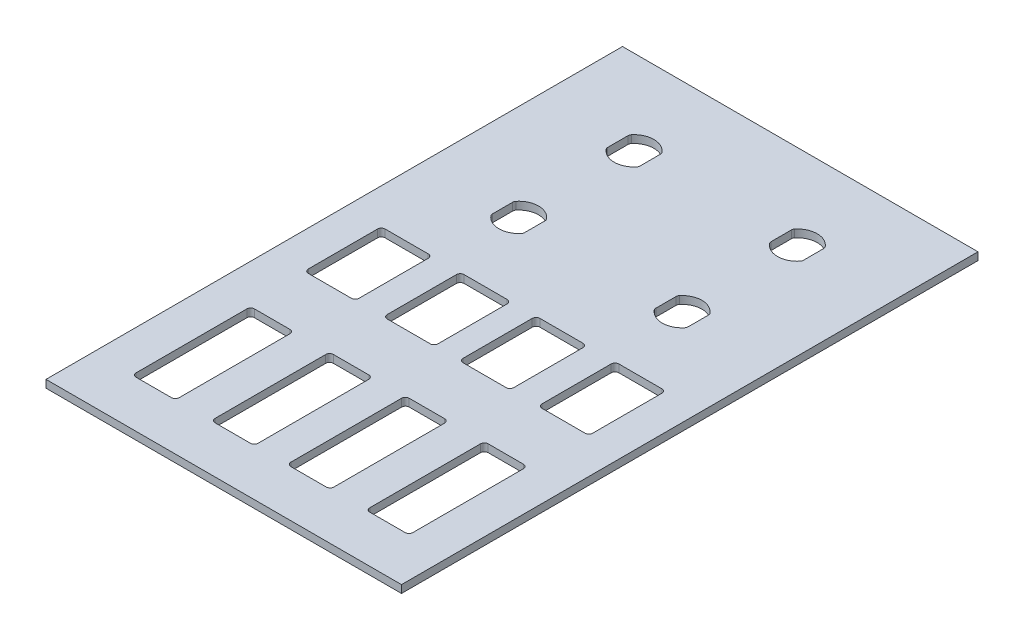
from build123d import *

# Parameters (mm, degrees)
SKIZZE1_W                       = 92.5
SKIZZE1_H                       = 150
AUFSATZ_LINEAR_AUSTRAGEN1_DEPTH = 2
SCHNITT_LINEAR_AUSTRAGEN1_DEPTH = 177.239184065
LINEARES_MUSTER1_COUNT          = 2
LINEARES_MUSTER1_PITCH          = 30
SPIEGELN1_COPY_1_DEPTH          = 177.239184065
SKIZZE3_W                       = 13.2
SKIZZE3_H                       = 20
SCHNITT_LINEAR_AUSTRAGEN2_DEPTH = 177.239184065
VERRUNDUNG1_R                   = 1
VERRUNDUNG2_R                   = 1
SKIZZE4_W                       = 11.2
SKIZZE4_H                       = 30.8
SCHNITT_LINEAR_AUSTRAGEN3_DEPTH = 177.239184065
VERRUNDUNG3_R                   = 1


with BuildPart() as part:
    # Skizze1 → Aufsatz-Linear austragen1 (new body)
    with BuildSketch(Plane(origin=(0, 0, 0), x_dir=(1, 0, 0), z_dir=(0, 1, 0))):
        with Locations((46.25, 75)):
            Rectangle(SKIZZE1_W, SKIZZE1_H)
    extrude(amount=AUFSATZ_LINEAR_AUSTRAGEN1_DEPTH)

    # Skizze2 → Schnitt-Linear austragen1 (cut, through all)
    with BuildSketch(Plane(origin=(0, 2, 0), x_dir=(1, 0, 0), z_dir=(0, 1, 0))):
        with BuildLine():
            Line((20.8, 130.980352328), (20.8, 125.019647672))
            ThreePointArc((20.8, 125.019647672), (25, 122.85), (29.2, 125.019647672))
            Line((29.2, 125.019647672), (29.2, 130.980352328))
            ThreePointArc((29.2, 130.980352328), (25, 133.15), (20.8, 130.980352328))
        make_face()
    schnitt_linear_austragen1 = extrude(amount=-SCHNITT_LINEAR_AUSTRAGEN1_DEPTH, mode=Mode.SUBTRACT)

    # Lineares Muster1: Schnitt-Linear austragen1 ×2
    with Locations(*[(0, 0, i * LINEARES_MUSTER1_PITCH) for i in range(1, LINEARES_MUSTER1_COUNT)]):
        add(schnitt_linear_austragen1, mode=Mode.SUBTRACT)

    # Spiegeln1: Schnitt-Linear austragen1 across plane
    add(schnitt_linear_austragen1.mirror(Plane(origin=(46.25, 0, 0), x_dir=(0, 0, 1), z_dir=(1, 0, 0))), mode=Mode.SUBTRACT)

    # Spiegeln1 copy 1 sketch → Spiegeln1 copy 1 (cut, through all)
    with BuildSketch(Plane(origin=(92.5, 2, 30), x_dir=(-1, 0, 0), z_dir=(0, 1, 0))):
        with BuildLine():
            Line((20.8, -130.980352328), (20.8, -125.019647672))
            ThreePointArc((20.8, -125.019647672), (25, -122.85), (29.2, -125.019647672))
            Line((29.2, -125.019647672), (29.2, -130.980352328))
            ThreePointArc((29.2, -130.980352328), (25, -133.15), (20.8, -130.980352328))
        make_face()
    extrude(amount=-SPIEGELN1_COPY_1_DEPTH, mode=Mode.SUBTRACT)

    # Skizze3 → Schnitt-Linear austragen2 (cut, through all)
    with BuildSketch(Plane(origin=(0, 2, 0), x_dir=(1, 0, 0), z_dir=(0, 1, 0))):
        with Locations((15.85, 68)):
            Rectangle(SKIZZE3_W, SKIZZE3_H)
        with Locations((56.115, 68)):
            Rectangle(SKIZZE3_W, SKIZZE3_H)
        with Locations((36.385, 68)):
            Rectangle(SKIZZE3_W, SKIZZE3_H)
        with Locations((76.65, 68)):
            Rectangle(SKIZZE3_W, SKIZZE3_H)
    extrude(amount=-SCHNITT_LINEAR_AUSTRAGEN2_DEPTH, mode=Mode.SUBTRACT)

    # Verrundung1
    verrundung1_edges = [part.edges().sort_by_distance(p)[0] for p in [
        (29.785, 1, -58),
        (29.785, 1, -78),
        (42.985, 1, -78),
        (42.985, 1, -58),
        (62.715, 1, -58),
        (49.515, 1, -58),
        (49.515, 1, -78),
        (62.715, 1, -78),
        (83.25, 1, -58),
        (70.05, 1, -58),
        (70.05, 1, -78),
        (83.25, 1, -78),
        (9.25, 1, -58),
        (9.25, 1, -78),
        (22.45, 1, -78),
        (22.45, 1, -58),
    ]]
    fillet(verrundung1_edges, radius=VERRUNDUNG1_R)

    # Verrundung2
    verrundung2_edges = [part.edges().sort_by_distance(p)[0] for p in [
        (20.8, 1, -130.980352328),
        (29.2, 1, -130.980352328),
        (29.2, 1, -125.019647672),
        (20.8, 1, -125.019647672),
        (20.8, 1, -100.980352328),
        (29.2, 1, -100.980352328),
        (29.2, 1, -95.019647672),
        (20.8, 1, -95.019647672),
        (63.3, 1, -130.980352328),
        (71.7, 1, -130.980352328),
        (71.7, 1, -125.019647672),
        (63.3, 1, -125.019647672),
        (63.3, 1, -100.980352328),
        (71.7, 1, -100.980352328),
        (71.7, 1, -95.019647672),
        (63.3, 1, -95.019647672),
    ]]
    fillet(verrundung2_edges, radius=VERRUNDUNG2_R)

    # Skizze4 → Schnitt-Linear austragen3 (cut, through all)
    with BuildSketch(Plane(origin=(0, 2, 0), x_dir=(1, 0, 0), z_dir=(0, 1, 0))):
        with Locations((15.85, 27.6)):
            Rectangle(SKIZZE4_W, SKIZZE4_H)
        with Locations((36.385, 27.6)):
            Rectangle(SKIZZE4_W, SKIZZE4_H)
    schnitt_linear_austragen3 = extrude(amount=-SCHNITT_LINEAR_AUSTRAGEN3_DEPTH, mode=Mode.SUBTRACT)

    # Spiegeln2: Schnitt-Linear austragen3 across plane
    add(schnitt_linear_austragen3.mirror(Plane(origin=(46.25, 0, 0), x_dir=(0, 0, 1), z_dir=(1, 0, 0))), mode=Mode.SUBTRACT)

    # Verrundung3
    verrundung3_edges = [part.edges().sort_by_distance(p)[0] for p in [
        (10.25, 1, -12.2),
        (10.25, 1, -43),
        (21.45, 1, -43),
        (21.45, 1, -12.2),
        (30.785, 1, -12.2),
        (30.785, 1, -43),
        (41.985, 1, -43),
        (41.985, 1, -12.2),
        (82.25, 1, -43),
        (82.25, 1, -12.2),
        (71.05, 1, -12.2),
        (71.05, 1, -43),
        (61.715, 1, -43),
        (61.715, 1, -12.2),
        (50.515, 1, -12.2),
        (50.515, 1, -43),
    ]]
    fillet(verrundung3_edges, radius=VERRUNDUNG3_R)


solid = part.part
